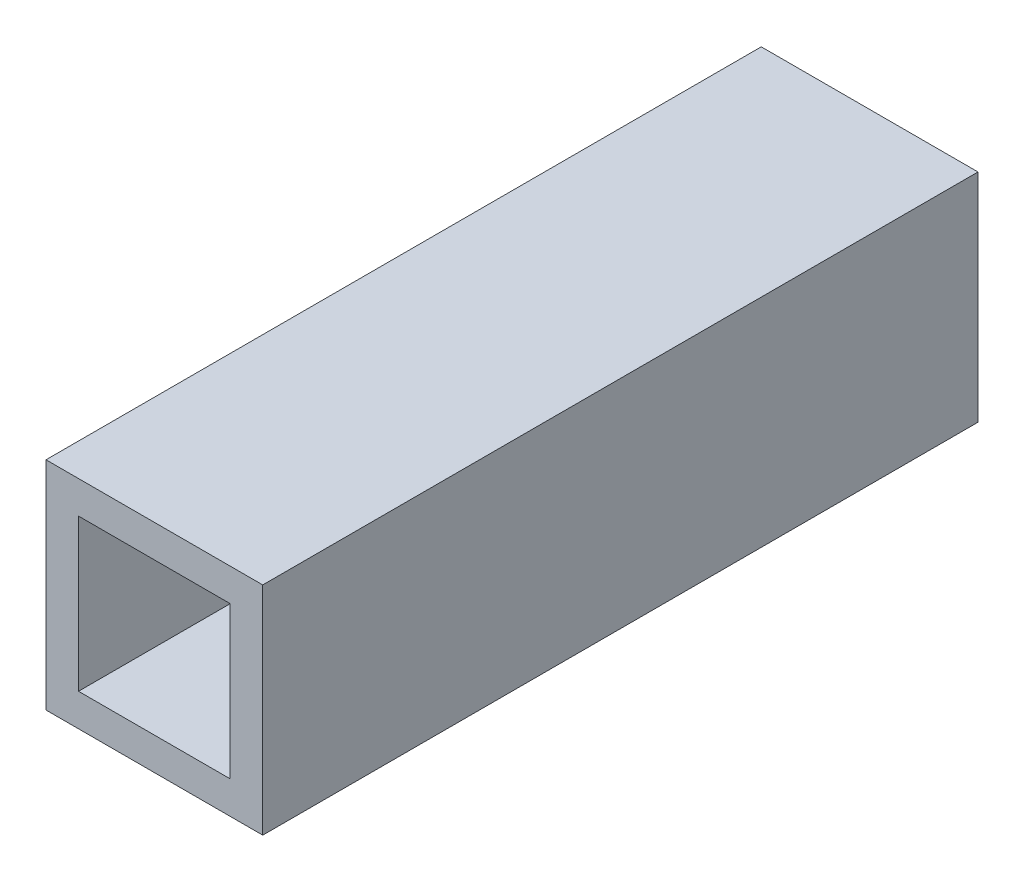
from build123d import *

# Parameters (mm, degrees)
SKETCH1_W           = 20
SKETCH1_H           = 20
BOSS_EXTRUDE1_DEPTH = 66
SHELL1_T            = -3


with BuildPart() as part:
    # Sketch1 → Boss-Extrude1 (new body)
    with BuildSketch(Plane.XY):
        with Locations((10, 10)):
            Rectangle(SKETCH1_W, SKETCH1_H)
    extrude(amount=BOSS_EXTRUDE1_DEPTH)

    # Shell1
    shell1_openings = [part.faces().sort_by_distance(p)[0] for p in [
        (10, 10, 66),
    ]]
    offset(amount=SHELL1_T, openings=shell1_openings, kind=Kind.INTERSECTION)


solid = part.part
